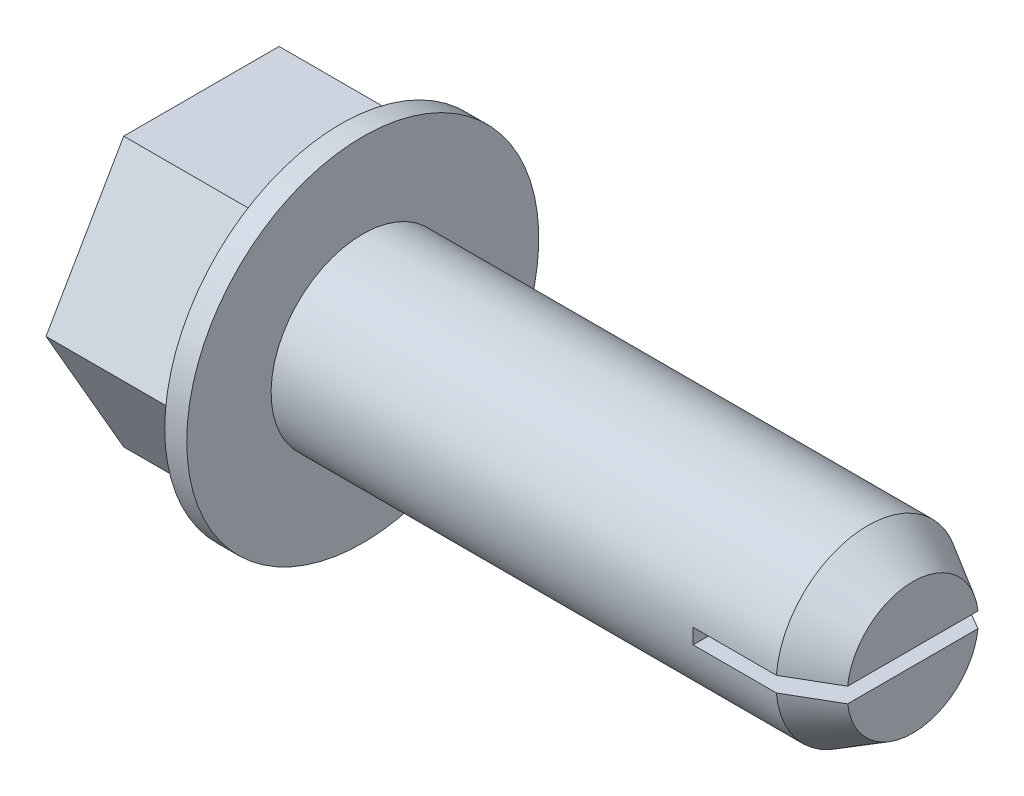
from build123d import *
from OCP.BRepFilletAPI import BRepFilletAPI_MakeChamfer
from build123d.topology import SkipClean

# Parameters (mm, degrees)
SKETCH1_W                  = 0.762
SKETCH1_H                  = 6.096
SKETCH2_R                  = 3.175
BOSS_EXTRUDE1_DEPTH        = 19.05
CUT_EXTRUDE1_START         = -4.445
CUT_EXTRUDE1_DEPTH         = 4.445
BOSS_EXTRUDE2_DEPTH        = 4.445
BOSS_EXTRUDE3_DEPTH        = 4.826
M6_5_CLEARANCE_HOLE1_D     = 7.45744
M6_5_CLEARANCE_HOLE1_DEPTH = 0.9652
CHAMFER1_SIZE              = 0.9017
CHAMFER1_SIZE2             = 1.561790213


with BuildPart() as part:
    # Sketch1 → Revolve1 (revolve)
    with BuildSketch(Plane(origin=(0, 0, 0), x_dir=(-1, 0, 0), z_dir=(0, 0, -1)), mode=Mode.PRIVATE) as revolve1_sk:
        with Locations((0.381, 3.048)):
            Rectangle(SKETCH1_W, SKETCH1_H)
    revolve(revolve1_sk.sketch.rotate(Axis((0, 0, 0), (-1, 0, 0)), 270), axis=Axis((0, 0, 0), (-1, 0, 0)))

    # Sketch2 → Boss-Extrude1 (add)
    with BuildSketch(Plane(origin=(0, 0, 0), x_dir=(0, 0, -1), z_dir=(1, 0, 0))):
        with Locations(Location((0, 0, 0), (0, 0, 180))):
            Circle(SKETCH2_R)
    extrude(amount=BOSS_EXTRUDE1_DEPTH)

    # Sketch3 → Cut-Extrude1 (cut)
    with BuildSketch(Plane(origin=(19.05, 0, 0), x_dir=(0, 0, -1), z_dir=(1, 0, 0)).offset(CUT_EXTRUDE1_START)):
        with BuildLine():
            Line((3.163956488, 0.264583333), (-3.163956488, 0.264583333))
            ThreePointArc((-3.163956488, 0.264583333), (0, -3.175), (3.163956488, 0.264583333))
        make_face()
    extrude(amount=CUT_EXTRUDE1_DEPTH, mode=Mode.SUBTRACT)

    # Sketch4 → Boss-Extrude2 (add)
    with SkipClean():  # the faces are left unmerged after this step: merging them gives an invalid solid
        with BuildSketch(Plane(origin=(14.605, 0, 0), x_dir=(0, 0, -1), z_dir=(1, 0, 0))):
            with BuildLine():
                Line((-3.163956488, -0.264583333), (3.163956488, -0.264583333))
                ThreePointArc((3.163956488, -0.264583333), (0, -3.175), (-3.163956488, -0.264583333))
            make_face()
        extrude(amount=BOSS_EXTRUDE2_DEPTH)

    # Sketch5 → Boss-Extrude3 (add)
    with SkipClean():  # the faces are left unmerged after this step: merging them gives an invalid solid
        with BuildSketch(Plane.ZY.offset(0.762)):
            Polygon((-5.381943739, 0), (-2.69097187, 4.6609), (2.69097187, 4.6609), (5.381943739, 0), (2.69097187, -4.6609), (-2.69097187, -4.6609), align=None)
        extrude(amount=BOSS_EXTRUDE3_DEPTH)

    # M6.5 Clearance Hole1
    with Locations(Plane.ZY.offset(5.588)):
        with Locations((0, 0)):
            Hole(M6_5_CLEARANCE_HOLE1_D / 2, depth=M6_5_CLEARANCE_HOLE1_DEPTH)

    # Chamfer1: one chamfer whose edges measure the first distance from different faces: ONE call of the kernel's chamfer builder (chamfer() names one face for all edges)
    chamfer1_edges_1 = [part.edges().sort_by_distance(p)[0] for p in [
        (19.05, -3.175, 0),
    ]]
    chamfer1_side_1 = [part.faces().sort_by_distance(p)[0] for p in [
        (19.05, -1.491577602, 0),
    ]]
    chamfer1_edges_2 = [part.edges().sort_by_distance(p)[0] for p in [
        (19.05, 3.175, 0),
    ]]
    chamfer1_side_2 = [part.faces().sort_by_distance(p)[0] for p in [
        (19.05, 1.491577602, 0),
    ]]
    chamfer1 = BRepFilletAPI_MakeChamfer(part.part.solid().wrapped)
    for e in chamfer1_edges_1:
        chamfer1.Add(CHAMFER1_SIZE, CHAMFER1_SIZE2, e.wrapped, chamfer1_side_1[0].wrapped)  # the first distance lies on this face
    for e in chamfer1_edges_2:
        chamfer1.Add(CHAMFER1_SIZE, CHAMFER1_SIZE2, e.wrapped, chamfer1_side_2[0].wrapped)  # the first distance lies on this face
    add(Compound.cast(chamfer1.Shape()), mode=Mode.REPLACE)


solid = part.part
